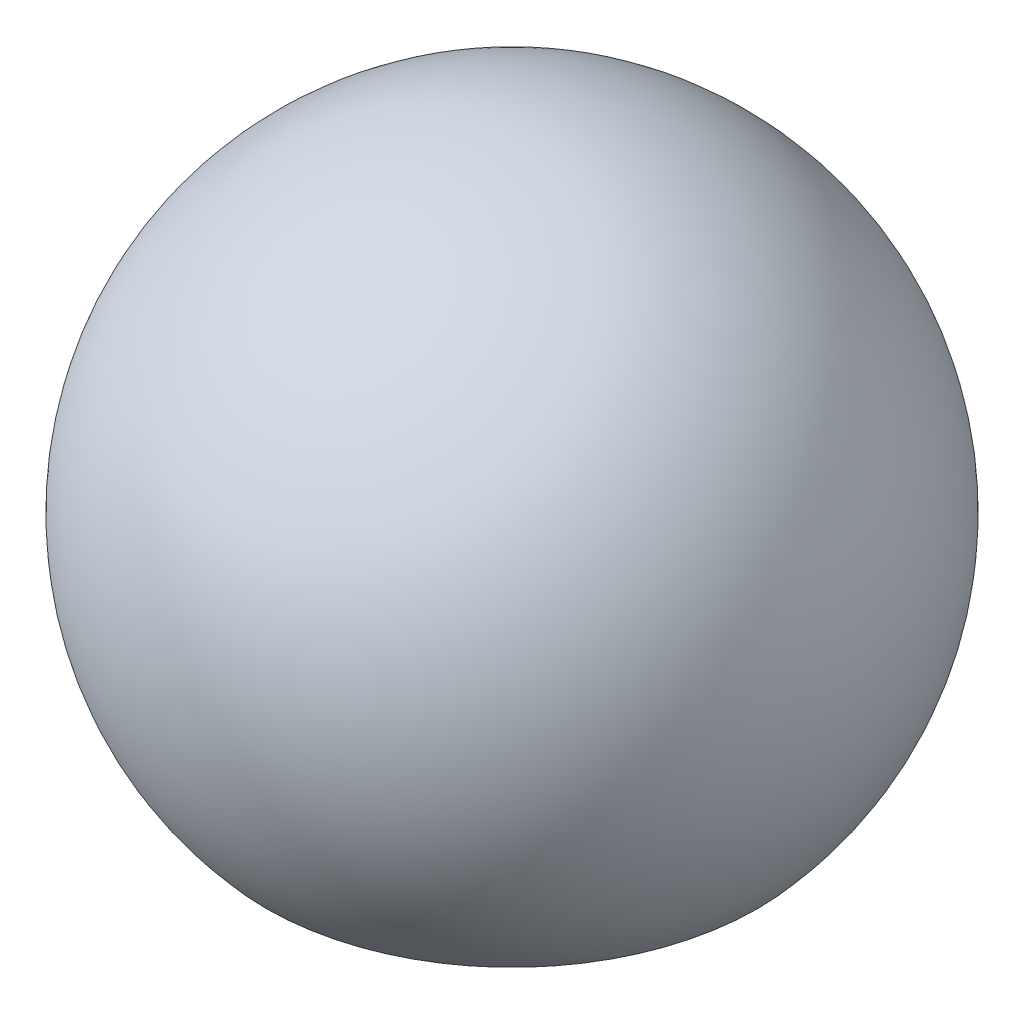
from build123d import *

# Parameters (mm, degrees)
SKETCH2_R          = 4
CUT_EXTRUDE1_DEPTH = 12


with BuildPart() as part:
    # Sketch1 → Revolve1 (revolve)
    with BuildSketch(Plane.XY):
        with BuildLine():
            Line((0, 12), (0, -8))
            Line((0, -8), (8.94427191, -8))
            ThreePointArc((8.94427191, -8), (10.95445115, 4.898979486), (0, 12))
        make_face()
    revolve(axis=Axis((0, 12, 0), (0, -1, 0)))

    # Sketch2 → Cut-Extrude1 (cut)
    with BuildSketch(Plane.XZ.offset(8)):
        Circle(SKETCH2_R)
    extrude(amount=-CUT_EXTRUDE1_DEPTH, mode=Mode.SUBTRACT)


solid = part.part
